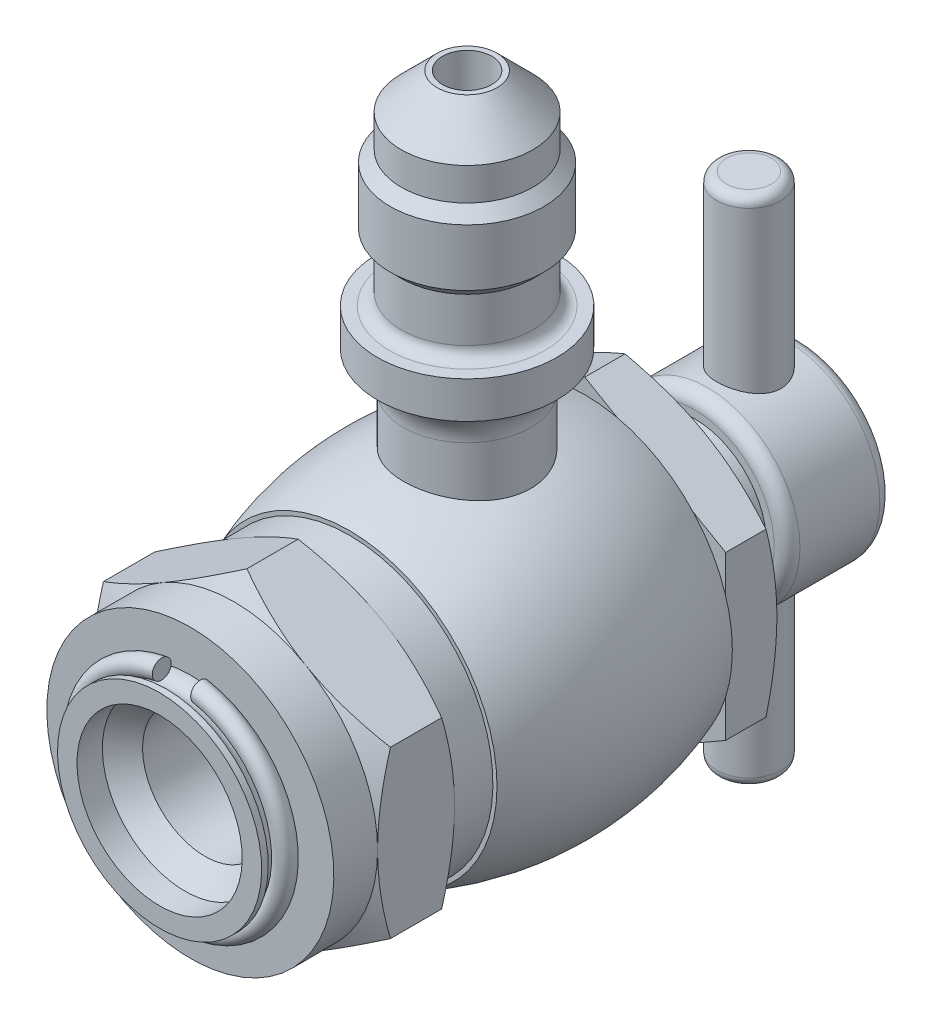
from build123d import *

# Parameters (mm, degrees)
SKETCH3_OUTSIDE_W      = 32.862
SKETCH3_OUTSIDE_H      = 32.862
CUT_EXTRUDE1_DEPTH     = 4.2672
BOSS_EXTRUDE1_START    = -7.47395
SKETCH4_R              = 5.1181
BOSS_EXTRUDE1_DEPTH    = 4.7625
FILLET1_R              = 0.79502
SKETCH6_R              = 1.984375
CUT_EXTRUDE2_DEPTH     = 30.14719181
SPLIT2_SURFACE_1_BACK  = 65.185
SPLIT2_SURFACE_1_DEPTH = 130.37
SPLIT2_SURFACE_2_BACK  = 65.185
SPLIT2_SURFACE_2_DEPTH = 130.37
SKETCH10_R             = 0.5842
SKETCH11_W             = 2.38125
SKETCH11_H             = 3.691809881
CUT_EXTRUDE4_DEPTH     = 5.334


with BuildPart() as part:
    # Sketch2 → Revolve1 (revolve)
    with BuildSketch(Plane(origin=(0, 0, 0), x_dir=(0, 0, -1), z_dir=(1, 0, 0))):
        with BuildLine():
            Line((-7.2898, 1.651), (-17.145, 1.651))
            Line((-17.145, 1.651), (-17.145, -0.9144))
            ThreePointArc((-17.145, -0.9144), (-17.894515223, -1.4605), (-18.644030447, -0.9144))
            Line((-18.644030447, -0.9144), (-19.05, -0.9144))
            Line((-19.05, -0.9144), (-19.05, -2.1209))
            Line((-19.05, -2.1209), (-17.4752, -2.1209))
            Line((-17.4752, -2.1209), (-16.2306, -3.3655))
            Line((-16.2306, -3.3655), (-11.4808, -3.3655))
            Line((-11.4808, -3.3655), (-11.4808, -4.8514))
            Line((-11.4808, -4.8514), (-9.779, -4.8514))
            Line((-9.779, -4.8514), (-9.779, -6.35))
            Line((-9.779, -6.35), (-8.1788, -6.35))
            Line((-8.1788, -6.35), (-8.1788, -7.239))
            Line((-8.1788, -7.239), (20.6375, -7.239))
            Line((20.6375, -7.239), (20.6375, -1.5113))
            Line((20.6375, -1.5113), (14.097, -1.5113))
            Line((14.097, -1.5113), (14.097, -2.794))
            Line((14.097, -2.794), (11.557, -2.794))
            Line((11.557, -2.794), (11.557, -0.7178675))
            Line((11.557, -0.7178675), (9.746690758, 2.921))
            Line((9.746690758, 2.921), (7.2898, 2.921))
            Line((7.2898, 2.921), (7.2898, 1.903738341))
            ThreePointArc((7.2898, 1.903738341), (0, 3.2385), (-7.2898, 1.903738341))
            Line((-7.2898, 1.903738341), (-7.2898, 1.651))
        make_face()
    revolve(axis=Axis((0, -7.239, -20.6375), (0, 0, 1)))

    # Sketch3 outside → Cut-Extrude1 (cut)
    with BuildSketch(Plane.XY.offset(-7.2898)):
        with Locations((0, -7.239)):
            Rectangle(SKETCH3_OUTSIDE_W, SKETCH3_OUTSIDE_H)
        Polygon((8.73125, -12.279989538), (8.73125, -2.198010462), (0, 2.842979076), (-8.73125, -2.198010462), (-8.73125, -12.279989538), (0, -17.320979076), align=None, mode=Mode.SUBTRACT)
    extrude(amount=-CUT_EXTRUDE1_DEPTH, mode=Mode.SUBTRACT)

    # Sketch4 → Boss-Extrude1 (add)
    with BuildSketch(Plane.XY.offset(17.145).offset(BOSS_EXTRUDE1_START)):
        Polygon((8.89, -12.371643893), (8.89, -2.106356107), (0, 3.026287786), (-8.89, -2.106356107), (-8.89, -12.371643893), (0, -17.504287786), align=None)
        with Locations(Location((0, -7.239, 0), (0, 0, 90))):
            Circle(SKETCH4_R, mode=Mode.SUBTRACT)
    extrude(amount=BOSS_EXTRUDE1_DEPTH)

    # Sketch5 → Cut-Revolve1 (revolve, cut)
    with BuildSketch(Plane(origin=(0, 0, 0), x_dir=(0, 0, -1), z_dir=(1, 0, 0)), mode=Mode.PRIVATE) as cut_revolve1_sk:
        Polygon((-14.43355, 1.651), (-12.845504453, 4.401575572), (-14.43355, 4.401575572), align=None)
        Polygon((-9.67105, 4.401575572), (-9.67105, 1.651), (-11.259095547, 4.401575572), align=None)
    revolve(cut_revolve1_sk.sketch.rotate(Axis((0, -7.239, -7.2898), (0, 0, 1)), 167.255228864), axis=Axis((0, -7.239, -7.2898), (0, 0, 1)), mode=Mode.SUBTRACT)

    # Fillet1
    fillet1_edges = [part.edges().sort_by_distance(p)[0] for p in [
        (0, -12.9667, -14.097),
        (0, -12.9667, -20.6375),
    ]]
    fillet(fillet1_edges, radius=FILLET1_R)

    # Sketch6 → Cut-Extrude2 (cut, through all)
    with BuildSketch(Plane(origin=(0, 0, 0), x_dir=(1, 0, 0), z_dir=(0, 1, 0))):
        with Locations(Location((0, 17.4625, 0), (0, 0, 270))):
            Circle(SKETCH6_R)
    extrude(amount=-CUT_EXTRUDE2_DEPTH, mode=Mode.SUBTRACT)

    # Sketch8 → Revolve3 (revolve)
    with BuildSketch(Plane(origin=(0, 0, 0), x_dir=(0, 0, -1), z_dir=(1, 0, 0))):
        with BuildLine():
            Line((3.937, 5.74675), (3.937, -7.239))
            Line((3.937, -7.239), (1.524, -7.239))
            Line((1.524, -7.239), (1.524, 22.94255))
            Line((1.524, 22.94255), (1.8542, 22.94255))
            Line((1.8542, 22.94255), (4.075092336, 20.721657664))
            Line((4.075092336, 20.721657664), (4.075092336, 18.707437664))
            Line((4.075092336, 18.707437664), (4.7625, 18.02003))
            Line((4.7625, 18.02003), (4.7625, 14.497725329))
            Line((4.7625, 14.497725329), (4.075092336, 13.810317664))
            Line((4.075092336, 13.810317664), (4.075092336, 11.059328832))
            ThreePointArc((4.075092336, 11.059328832), (4.292002854, 10.535660518), (4.815671168, 10.31875))
            Line((4.815671168, 10.31875), (5.55625, 10.31875))
            Line((5.55625, 10.31875), (5.55625, 8.03275))
            ThreePointArc((5.55625, 8.03275), (4.382822734, 7.147443271), (3.937, 5.74675))
        make_face()
    revolve(axis=Axis((0, -7.239, 0), (0, 1, 0)))


with BuildPart() as body_2:
    # Sketch7 → Revolve2 (revolve)
    with BuildSketch(Plane(origin=(0, 0, 0), x_dir=(0, 0, -1), z_dir=(1, 0, 0)), mode=Mode.PRIVATE) as revolve2_sk:
        with BuildLine():
            Line((17.4625, 8.80745), (17.4625, -22.94255))
            Line((17.4625, -22.94255), (18.8515625, -22.94255))
            ThreePointArc((18.8515625, -22.94255), (19.272512006, -22.768187006), (19.446875, -22.3472375))
            Line((19.446875, -22.3472375), (19.446875, 8.2121375))
            ThreePointArc((19.446875, 8.2121375), (19.272512006, 8.633087006), (18.8515625, 8.80745))
            Line((18.8515625, 8.80745), (17.4625, 8.80745))
        make_face()
    revolve(revolve2_sk.sketch.rotate(Axis((0, 8.80745, -17.4625), (0, -1, 0)), 180), axis=Axis((0, 8.80745, -17.4625), (0, -1, 0)))


with BuildPart() as body_3:
    # Split2: the piece behind the surface
    add(part.part)
    # Split2 surface: a surface, the sketch's curves swept straight by 130.37 mm
    with BuildLine(Plane(origin=(0, 0, 0), x_dir=(0, 0, -1), z_dir=(1, 0, 0)).offset(-SPLIT2_SURFACE_1_BACK), mode=Mode.PRIVATE) as split2_surface_1_path:
        Line((-7.2898, 5.74675), (-7.2898, -22.3472375))
        Line((-7.2898, -22.3472375), (7.2898, -22.3472375))
        Line((7.2898, -22.3472375), (7.2898, 5.74675))
        Line((7.2898, 5.74675), (11.557, 5.74675))
        Line((11.557, 5.74675), (11.557, -22.3472375))
    split2_surface_1 = Shell.extrude(split2_surface_1_path.wire(), (1 * SPLIT2_SURFACE_1_DEPTH, 0 * SPLIT2_SURFACE_1_DEPTH, 0 * SPLIT2_SURFACE_1_DEPTH))
    split(bisect_by=split2_surface_1, keep=Keep.BOTTOM)


with BuildPart() as part_1:
    add(part.part)

    # Split2: split by a surface, the side it looks to stays
    # Split2 surface: a surface, the sketch's curves swept straight by 130.37 mm
    with BuildLine(Plane(origin=(0, 0, 0), x_dir=(0, 0, -1), z_dir=(1, 0, 0)).offset(-SPLIT2_SURFACE_2_BACK), mode=Mode.PRIVATE) as split2_surface_2_path:
        Line((-7.2898, 5.74675), (-7.2898, -22.3472375))
        Line((-7.2898, -22.3472375), (7.2898, -22.3472375))
        Line((7.2898, -22.3472375), (7.2898, 5.74675))
        Line((7.2898, 5.74675), (11.557, 5.74675))
        Line((11.557, 5.74675), (11.557, -22.3472375))
    split2_surface_2 = Shell.extrude(split2_surface_2_path.wire(), (1 * SPLIT2_SURFACE_2_DEPTH, 0 * SPLIT2_SURFACE_2_DEPTH, 0 * SPLIT2_SURFACE_2_DEPTH))
    split(bisect_by=split2_surface_2, keep=Keep.TOP)


with BuildPart() as body_4:
    # Sketch10 → Revolve4 (revolve)
    with BuildSketch(Plane(origin=(0, 0, 0), x_dir=(0, 0, -1), z_dir=(1, 0, 0))):
        with Locations((-17.7292, -0.79125717)):
            Circle(SKETCH10_R)
    revolve(axis=Axis((0, -7.239, 7.2898), (0, 0, 1)))

    # Sketch11 → Cut-Extrude4 (cut)
    with BuildSketch(Plane.XY.offset(19.05)):
        with Locations((0, -0.27499506)):
            Rectangle(SKETCH11_W, SKETCH11_H)
    extrude(amount=-CUT_EXTRUDE4_DEPTH, mode=Mode.SUBTRACT)


solid = Compound([body_2.part, body_3.part, part_1.part, body_4.part])
